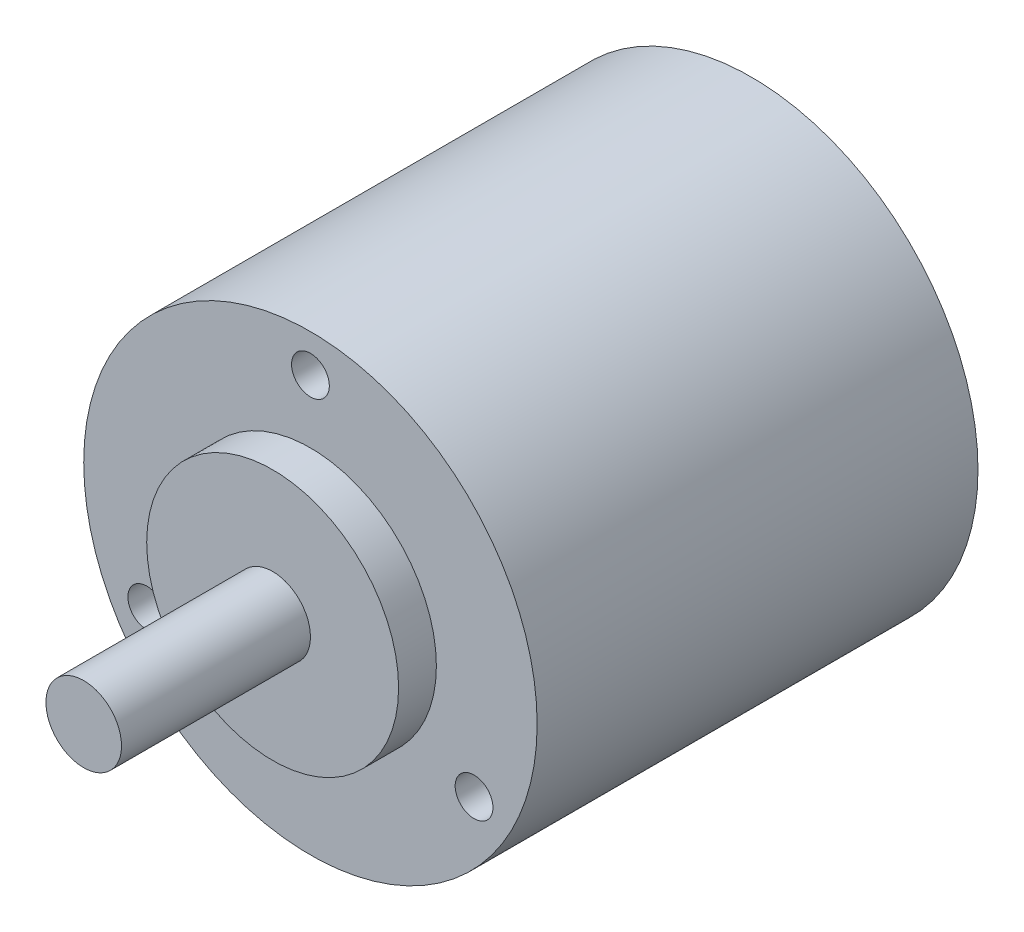
from build123d import *

# Parameters (mm, degrees)
SKETCH1_R           = 18
BOSS_EXTRUDE1_DEPTH = 35
SKETCH2_R           = 10
BOSS_EXTRUDE2_DEPTH = 3
SKETCH3_R           = 3
BOSS_EXTRUDE3_DEPTH = 15
SKETCH4_R           = 1.5
CUT_EXTRUDE1_DEPTH  = 15


with BuildPart() as part:
    # Sketch1 → Boss-Extrude1 (new body)
    with BuildSketch(Plane.XY):
        Circle(SKETCH1_R)
    extrude(amount=BOSS_EXTRUDE1_DEPTH)

    # Sketch2 → Boss-Extrude2 (add)
    with BuildSketch(Plane.XY.offset(35)):
        Circle(SKETCH2_R)
    extrude(amount=BOSS_EXTRUDE2_DEPTH)

    # Sketch3 → Boss-Extrude3 (add)
    with BuildSketch(Plane.XY.offset(38)):
        Circle(SKETCH3_R)
    extrude(amount=BOSS_EXTRUDE3_DEPTH)

    # Sketch4 → Cut-Extrude1 (cut)
    with BuildSketch(Plane.XY.offset(35)):
        with Locations((0, 15)):
            Circle(SKETCH4_R)
        with Locations((12.990381057, -7.5)):
            Circle(SKETCH4_R)
        with Locations((-12.990381057, -7.5)):
            Circle(SKETCH4_R)
    extrude(amount=-CUT_EXTRUDE1_DEPTH, mode=Mode.SUBTRACT)


solid = part.part
